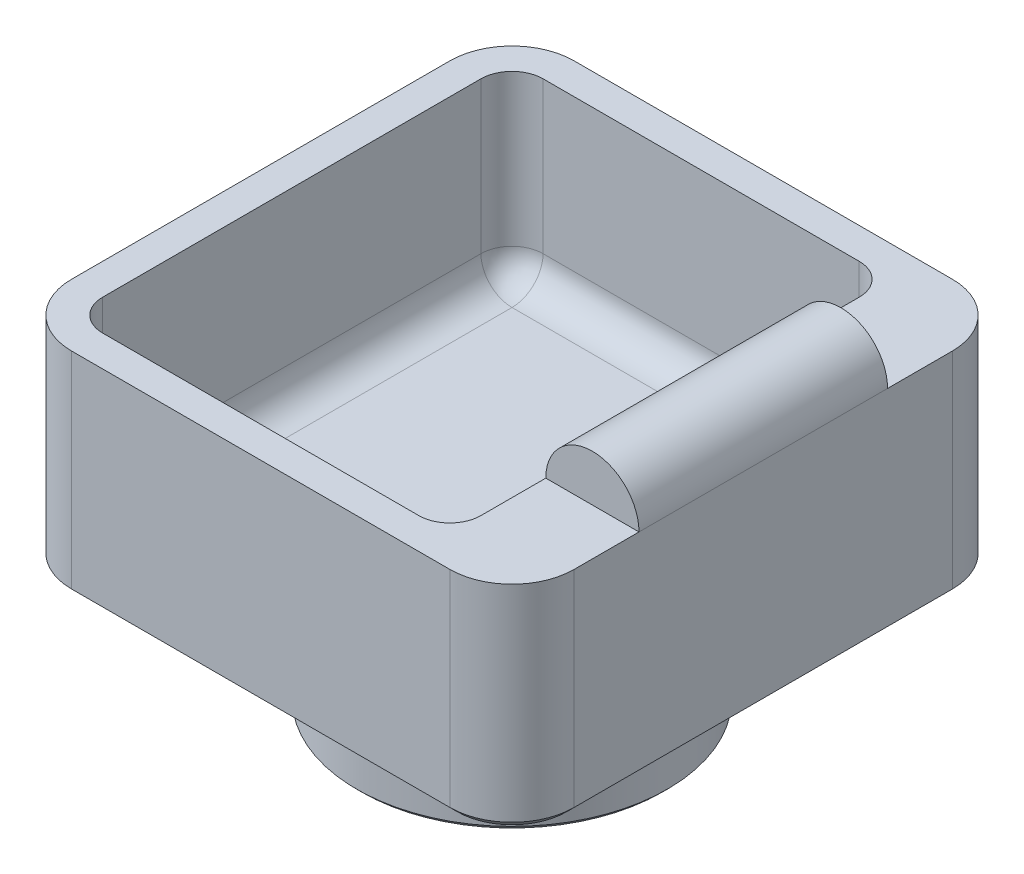
from build123d import *

# Parameters (mm, degrees)
SKETCH1_W           = 51.355839692
SKETCH1_H           = 51.355839692
BOSS_EXTRUDE1_DEPTH = 21.828125
FILLET1_R           = 6.35
SHELL1_T            = -3.175
SKETCH2_R           = 15.875
BOSS_EXTRUDE2_DEPTH = 12.7
SKETCH3_W           = 6.35
SKETCH3_H           = 45.005839692
BOSS_EXTRUDE3_DEPTH = 18.653125
SKETCH4_R           = 4.7625
BOSS_EXTRUDE4_DEPTH = 12.7
CUT_EXTRUDE1_DEPTH  = 25.4
SKETCH6_R           = 1.966828055
BOSS_EXTRUDE5_DEPTH = 0.79375
FILLET2_R           = 3.175
FILLET3_R           = 3.175
SKETCH8_R           = 13.335
CUT_EXTRUDE2_DEPTH  = 12.7
CUT_EXTRUDE3_START  = -6.35
SKETCH9_R           = 0.1
CUT_EXTRUDE3_DEPTH  = 8.89
CIRPATTERN1_COUNT   = 4
CHAMFER4_SIZE       = 0.762
CHAMFER5_SIZE       = 0.508


with BuildPart() as part:
    # Sketch1 → Boss-Extrude1 (new body)
    with BuildSketch(Plane(origin=(0, 0, 0), x_dir=(1, 0, 0), z_dir=(0, 1, 0))):
        Rectangle(SKETCH1_W, SKETCH1_H)
    extrude(amount=BOSS_EXTRUDE1_DEPTH)

    # Fillet1
    fillet1_edges = [part.edges().sort_by_distance(p)[0] for p in [
        (25.677919846, 10.9140625, -25.677919846),
        (25.677919846, 10.9140625, 25.677919846),
        (-25.677919846, 10.9140625, 25.677919846),
        (-25.677919846, 10.9140625, -25.677919846),
    ]]
    fillet(fillet1_edges, radius=FILLET1_R)

    # Shell1
    shell1_openings = [part.faces().sort_by_distance(p)[0] for p in [
        (0, 21.828125, 0),
    ]]
    offset(amount=SHELL1_T, openings=shell1_openings, kind=Kind.INTERSECTION)

    # Sketch2 → Boss-Extrude2 (add)
    with BuildSketch(Plane.XZ):
        with Locations(Location((0, 0, 0), (0, 0, 270))):
            Circle(SKETCH2_R)
    extrude(amount=BOSS_EXTRUDE2_DEPTH)

    # Sketch3 → Boss-Extrude3 (add)
    with BuildSketch(Plane(origin=(0, 3.175, 0), x_dir=(1, 0, 0), z_dir=(0, 1, 0))):
        with Locations((19.327919846, 0)):
            Rectangle(SKETCH3_W, SKETCH3_H)
    extrude(amount=BOSS_EXTRUDE3_DEPTH)

    # Sketch4 → Boss-Extrude4 (add, symmetric)
    with BuildSketch(Plane.XY):
        with Locations((20.915419846, 21.828125)):
            Circle(SKETCH4_R)
    extrude(amount=BOSS_EXTRUDE4_DEPTH, both=True)

    # Sketch5 → Cut-Extrude1 (cut)
    with BuildSketch(Plane.XY.offset(12.7)):
        with BuildLine():
            ThreePointArc((22.502919846, 24.209375), (22.037951861, 25.331907015), (20.915419846, 25.796875))
            Line((20.915419846, 25.796875), (20.915419846, 22.621875))
            ThreePointArc((20.915419846, 22.621875), (22.037951861, 23.086842985), (22.502919846, 24.209375))
        make_face()
        with BuildLine():
            Line((20.915419846, 22.621875), (20.915419846, 25.796875))
            ThreePointArc((20.915419846, 25.796875), (19.327919846, 24.209375), (20.915419846, 22.621875))
        make_face()
    extrude(amount=-CUT_EXTRUDE1_DEPTH, mode=Mode.SUBTRACT)

    # Sketch6 → Boss-Extrude5 (add)
    with BuildSketch(Plane.XY.offset(12.7)):
        with Locations((20.915419846, 24.209375)):
            Circle(SKETCH6_R)
    extrude(amount=-BOSS_EXTRUDE5_DEPTH)

    # Fillet2
    fillet2_edges = [part.edges().sort_by_distance(p)[0] for p in [
        (16.152919846, 12.5015625, 22.502919846),
        (16.152919846, 12.5015625, -22.502919846),
    ]]
    fillet(fillet2_edges, radius=FILLET2_R)

    # Fillet3
    fillet3_edges = [part.edges().sort_by_distance(p)[0] for p in [
        (16.152919846, 3.175, 0),
        (-3.175, 3.175, -22.502919846),
        (15.222983876, 3.175, -21.572983876),
        (15.222983876, 3.175, 21.572983876),
        (-22.502919846, 3.175, 0),
        (-3.175, 3.175, 22.502919846),
        (-21.572983876, 3.175, 21.572983876),
        (-21.572983876, 3.175, -21.572983876),
    ]]
    fillet(fillet3_edges, radius=FILLET3_R)

    # Sketch8 → Cut-Extrude2 (cut)
    with BuildSketch(Plane.XZ.offset(12.7)):
        with Locations(Location((0, 0, 0), (0, 0, 270))):
            Circle(SKETCH8_R)
    extrude(amount=-CUT_EXTRUDE2_DEPTH, mode=Mode.SUBTRACT)

    # Sketch9 → Cut-Extrude3 (cut)
    with BuildSketch(Plane(origin=(0, 0, 0), x_dir=(1, 0, 0), z_dir=(0, 1, 0)).offset(CUT_EXTRUDE3_START)):
        with Locations(Location((-14.605, 0, 0), (0, 0, 270))):
            Circle(SKETCH9_R)
    cut_extrude3 = extrude(amount=CUT_EXTRUDE3_DEPTH, mode=Mode.SUBTRACT)

    # CirPattern1: Cut-Extrude3 ×4 about axis
    cirpattern1_axis = Axis((0, 0, 0), (0, 1, 0))
    for i in range(1, CIRPATTERN1_COUNT):
        add(cut_extrude3.rotate(cirpattern1_axis, i * 360 / CIRPATTERN1_COUNT), mode=Mode.SUBTRACT)

    # Chamfer4
    chamfer4_edges = [part.edges().sort_by_distance(p)[0] for p in [
        (0, 0, -25.677919846),
        (25.677919846, 0, 0),
        (0, 0, 25.677919846),
        (-25.677919846, 0, 0),
        (-23.818047907, 0, -23.818047907),
        (-23.818047907, 0, 23.818047907),
        (23.818047907, 0, 23.818047907),
        (23.818047907, 0, -23.818047907),
    ]]
    chamfer(chamfer4_edges, length=CHAMFER4_SIZE)

    # Chamfer5
    chamfer5_edges = [part.edges().sort_by_distance(p)[0] for p in [
        (0, -12.7, 13.335),
        (0, -12.7, 15.875),
    ]]
    chamfer(chamfer5_edges, length=CHAMFER5_SIZE)


solid = part.part
